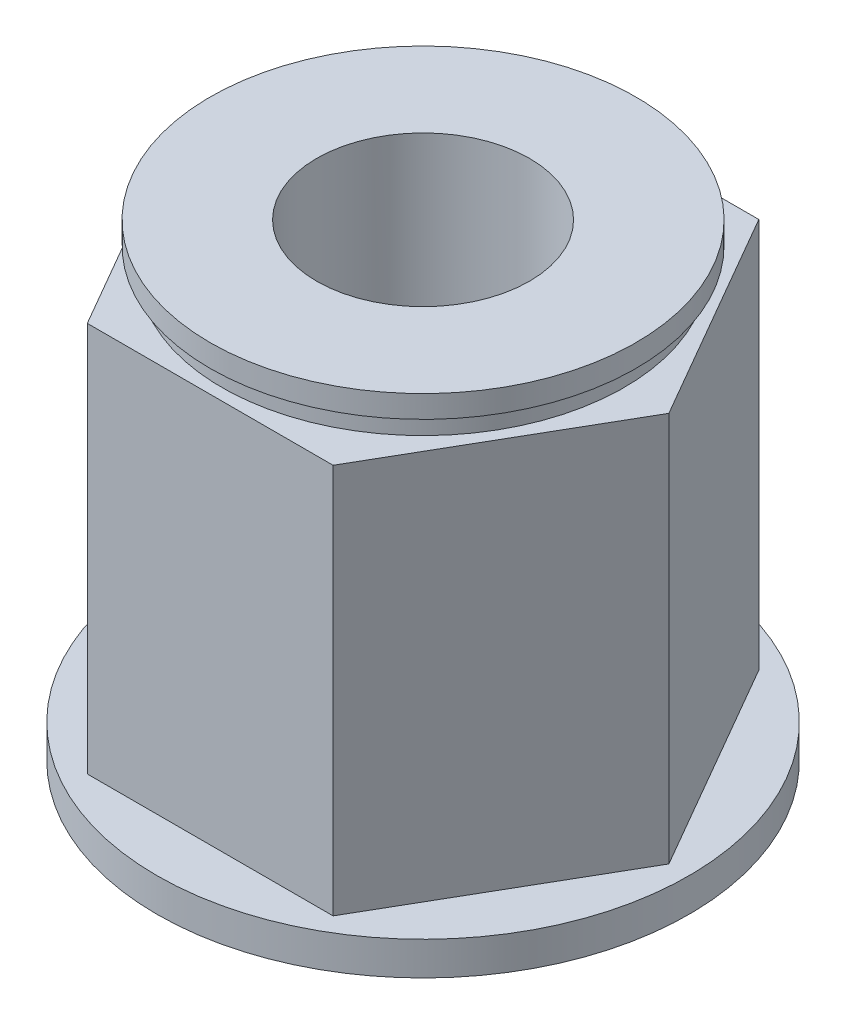
from build123d import *

# Parameters (mm, degrees)
SKETCH1_W            = 11.90625
SKETCH1_H            = 1.5
BOSS_EXTRUDE1_DEPTH  = 17.4625
SKETCH3_W            = 9
SKETCH3_H            = 1
SKETCH6_R            = 9.525
BOSS_EXTRUDE2_DEPTH  = 1
M8_CLEARANCE_HOLE1_D = 9.525


with BuildPart() as part:
    # Sketch1 → Revolve1 (revolve)
    with BuildSketch(Plane(origin=(0, 0, 0), x_dir=(-1, 0, 0), z_dir=(0, 0, -1)), mode=Mode.PRIVATE) as revolve1_sk:
        with Locations((-5.953125, -0.75)):
            Rectangle(SKETCH1_W, SKETCH1_H)
    revolve(revolve1_sk.sketch.rotate(Axis((0, -1.5, 0), (0, 1, 0)), 270), axis=Axis((0, -1.5, 0), (0, 1, 0)))

    # Sketch2 → Boss-Extrude1 (add)
    with BuildSketch(Plane(origin=(0, 0, 0), x_dir=(-1, 0, 0), z_dir=(0, 1, 0))):
        Polygon((10.998522628, 0), (5.499261314, -9.525), (-5.499261314, -9.525), (-10.998522628, 0), (-5.499261314, 9.525), (5.499261314, 9.525), align=None)
    extrude(amount=BOSS_EXTRUDE1_DEPTH)

    # Sketch3 → Revolve2 (revolve)
    with BuildSketch(Plane.XY, mode=Mode.PRIVATE) as revolve2_sk:
        with Locations((4.5, 17.9625)):
            Rectangle(SKETCH3_W, SKETCH3_H)
    revolve(revolve2_sk.sketch.rotate(Axis((0, 18.4625, 0), (0, -1, 0)), 270), axis=Axis((0, 18.4625, 0), (0, -1, 0)))

    # Sketch6 → Boss-Extrude2 (add)
    with BuildSketch(Plane(origin=(0, 18.4625, 0), x_dir=(1, 0, 0), z_dir=(0, 1, 0))):
        with Locations(Location((0, 0, 0), (0, 0, 270))):
            Circle(SKETCH6_R)
    extrude(amount=BOSS_EXTRUDE2_DEPTH)

    # M8 Clearance Hole1 (through all)
    with Locations(Plane(origin=(0, -1.5, 0), x_dir=(-1, 0, 0), z_dir=(0, -1, 0))):
        with Locations((0, 0)):
            Hole(M8_CLEARANCE_HOLE1_D / 2)


solid = part.part
